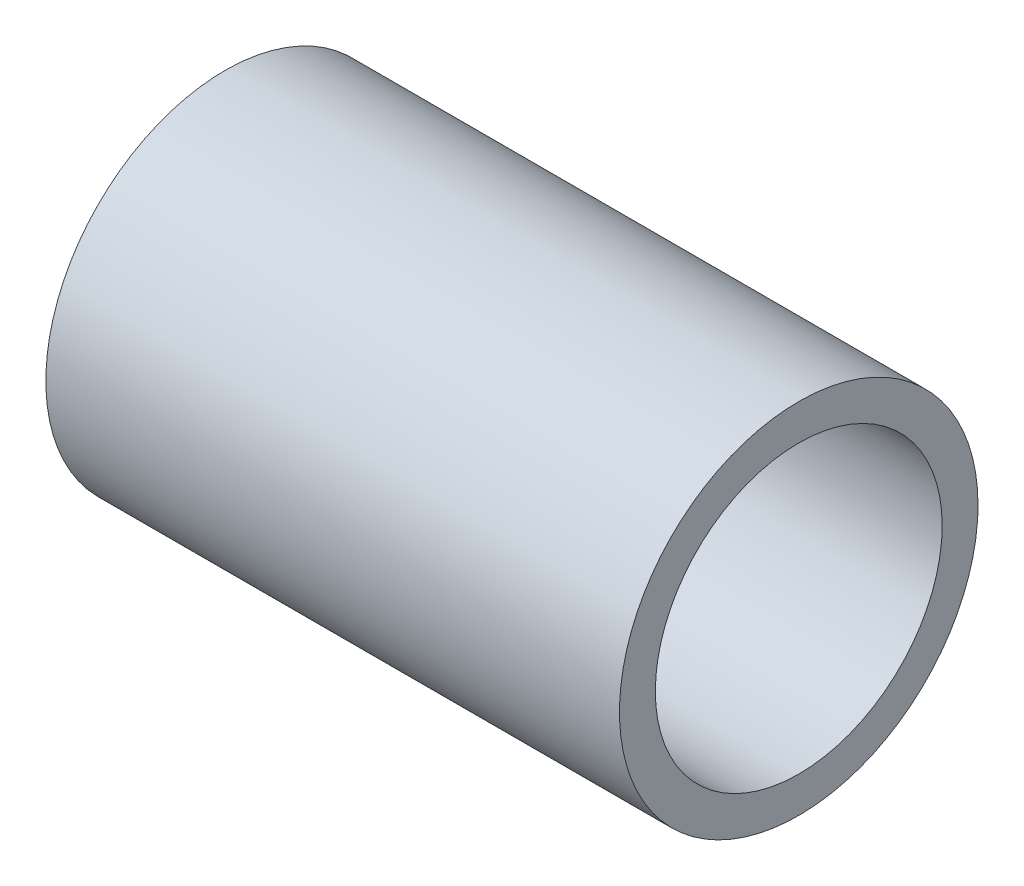
from build123d import *

# Parameters (mm, degrees)
SKETCH_1_R          = 25
SKETCH_1_R_2        = 20
EXTRUDE_1_DEPTH     = 80
SKETCH_2_W          = 5
SKETCH_2_H          = 4
CUT_EXTRUDE_1_DEPTH = 80


with BuildPart() as part:
    # Эскиз1 → Бобышка-Вытянуть1 (new body)
    with BuildSketch(Plane(origin=(0, 0, 0), x_dir=(0, 0, -1), z_dir=(1, 0, 0))):
        Circle(SKETCH_1_R)
        Circle(SKETCH_1_R_2, mode=Mode.SUBTRACT)
    extrude(amount=EXTRUDE_1_DEPTH)

    # Эскиз2 → Вырез-Вытянуть1 (cut)
    with BuildSketch(Plane.XY):
        with Locations((2.5, 0)):
            Rectangle(SKETCH_2_W, SKETCH_2_H)
    extrude(amount=-CUT_EXTRUDE_1_DEPTH, mode=Mode.SUBTRACT)


solid = part.part
